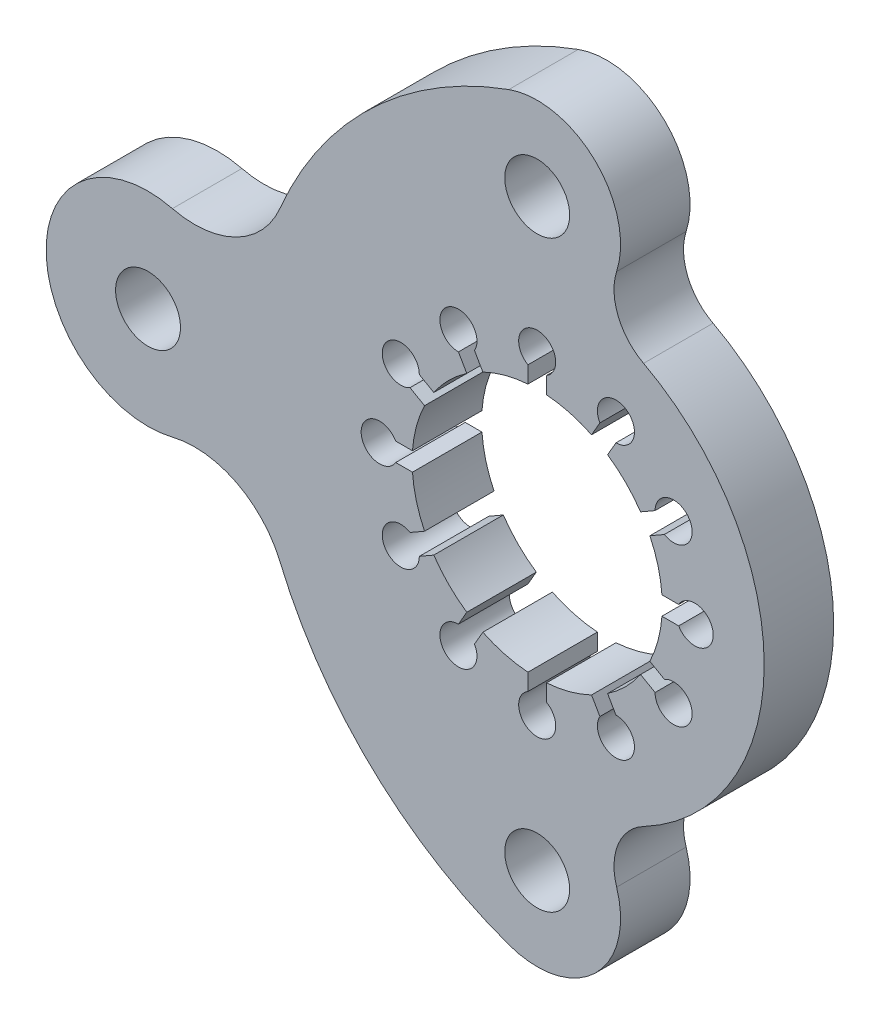
from build123d import *

# Parameters (mm, degrees)
SALIENTE_EXTRUIR1_DEPTH = 15
CROQUIS2_R              = 7
CORTAR_EXTRUIR1_DEPTH   = 135.246042772


with BuildPart() as part:
    # Croquis1 → Saliente-Extruir1 (new body)
    with BuildSketch(Plane.XY):
        with BuildLine():
            ThreePointArc((22.960111456, -43.287795993), (49, 0), (22.960111456, 43.287795993))
            ThreePointArc((22.960111456, 43.287795993), (17.471680778, 49.356927241), (17.149797537, 57.533333333))
            ThreePointArc((17.149797537, 57.533333333), (12.479188654, 75.97188693), (-6.126315717, 79.925373134))
            ThreePointArc((-6.126315717, 79.925373134), (-35.730309716, 61.63434209), (-55.523644659, 33.012983471))
            ThreePointArc((-55.523644659, 33.012983471), (-64.981782963, 22.905981014), (-78.737580645, 21.361342246))
            ThreePointArc((-78.737580645, 21.361342246), (-106, 0), (-78.737580645, -21.361342246))
            ThreePointArc((-78.737580645, -21.361342246), (-64.981782963, -22.905981014), (-55.523644659, -33.012983471))
            ThreePointArc((-55.523644659, -33.012983471), (-35.730309716, -61.63434209), (-6.126315717, -79.925373134))
            ThreePointArc((-6.126315717, -79.925373134), (12.479188654, -75.97188693), (17.149797537, -57.533333333))
            ThreePointArc((17.149797537, -57.533333333), (17.471680778, -49.356927241), (22.960111456, -43.287795993))
        make_face()
    extrude(amount=-SALIENTE_EXTRUIR1_DEPTH)

    # Croquis2 → Cortar-Extruir1 (cut, through all)
    with BuildSketch(Plane.XY):
        with Locations((0, 63)):
            Circle(CROQUIS2_R)
        with Locations((-84, 0)):
            Circle(CROQUIS2_R)
        with Locations((0, -63)):
            Circle(CROQUIS2_R)
        with BuildLine():
            Line((-2, 30.535898385), (-2, 26.925824036))
            ThreePointArc((-2, 26.925824036), (-6.988114218, 26.07999731), (-11.73086121, 24.318447633))
            Line((-11.73086121, 24.318447633), (-13.535898385, 27.444863729))
            ThreePointArc((-13.535898385, 27.444863729), (-19, 32.908965344), (-17, 25.444863729))
            Line((-17, 25.444863729), (-15.194962825, 22.318447633))
            ThreePointArc((-15.194962825, 22.318447633), (-19.091883092, 19.091883092), (-22.318447633, 15.194962825))
            Line((-22.318447633, 15.194962825), (-25.444863729, 17))
            ThreePointArc((-25.444863729, 17), (-32.908965344, 19), (-27.444863729, 13.535898385))
            Line((-27.444863729, 13.535898385), (-24.318447633, 11.73086121))
            ThreePointArc((-24.318447633, 11.73086121), (-26.07999731, 6.988114218), (-26.925824036, 2))
            Line((-26.925824036, 2), (-30.535898385, 2))
            ThreePointArc((-30.535898385, 2), (-38, 0), (-30.535898385, -2))
            Line((-30.535898385, -2), (-26.925824036, -2))
            ThreePointArc((-26.925824036, -2), (-26.07999731, -6.988114218), (-24.318447633, -11.73086121))
            Line((-24.318447633, -11.73086121), (-27.444863729, -13.535898385))
            ThreePointArc((-27.444863729, -13.535898385), (-32.908965344, -19), (-25.444863729, -17))
            Line((-25.444863729, -17), (-22.318447633, -15.194962825))
            ThreePointArc((-22.318447633, -15.194962825), (-19.091883092, -19.091883092), (-15.194962825, -22.318447633))
            Line((-15.194962825, -22.318447633), (-17, -25.444863729))
            ThreePointArc((-17, -25.444863729), (-19, -32.908965344), (-13.535898385, -27.444863729))
            Line((-13.535898385, -27.444863729), (-11.73086121, -24.318447633))
            ThreePointArc((-11.73086121, -24.318447633), (-6.988114218, -26.07999731), (-2, -26.925824036))
            Line((-2, -26.925824036), (-2, -30.535898385))
            ThreePointArc((-2, -30.535898385), (0, -38), (2, -30.535898385))
            Line((2, -30.535898385), (2, -26.925824036))
            ThreePointArc((2, -26.925824036), (6.988114218, -26.07999731), (11.73086121, -24.318447633))
            Line((11.73086121, -24.318447633), (13.535898385, -27.444863729))
            ThreePointArc((13.535898385, -27.444863729), (19, -32.908965344), (17, -25.444863729))
            Line((17, -25.444863729), (15.194962825, -22.318447633))
            ThreePointArc((15.194962825, -22.318447633), (19.091883092, -19.091883092), (22.318447633, -15.194962825))
            Line((22.318447633, -15.194962825), (25.444863729, -17))
            ThreePointArc((25.444863729, -17), (32.908965344, -19), (27.444863729, -13.535898385))
            Line((27.444863729, -13.535898385), (24.318447633, -11.73086121))
            ThreePointArc((24.318447633, -11.73086121), (26.07999731, -6.988114218), (26.925824036, -2))
            Line((26.925824036, -2), (30.535898385, -2))
            ThreePointArc((30.535898385, -2), (38, 0), (30.535898385, 2))
            Line((30.535898385, 2), (26.925824036, 2))
            ThreePointArc((26.925824036, 2), (26.07999731, 6.988114218), (24.318447633, 11.73086121))
            Line((24.318447633, 11.73086121), (27.444863729, 13.535898385))
            ThreePointArc((27.444863729, 13.535898385), (32.908965344, 19), (25.444863729, 17))
            Line((25.444863729, 17), (22.318447633, 15.194962825))
            ThreePointArc((22.318447633, 15.194962825), (19.091883092, 19.091883092), (15.194962825, 22.318447633))
            Line((15.194962825, 22.318447633), (17, 25.444863729))
            ThreePointArc((17, 25.444863729), (19, 32.908965344), (13.535898385, 27.444863729))
            Line((13.535898385, 27.444863729), (11.73086121, 24.318447633))
            ThreePointArc((11.73086121, 24.318447633), (6.988114218, 26.07999731), (2, 26.925824036))
            Line((2, 26.925824036), (2, 30.535898385))
            ThreePointArc((2, 30.535898385), (0, 38), (-2, 30.535898385))
        make_face()
    extrude(amount=-CORTAR_EXTRUIR1_DEPTH, mode=Mode.SUBTRACT)


solid = part.part
